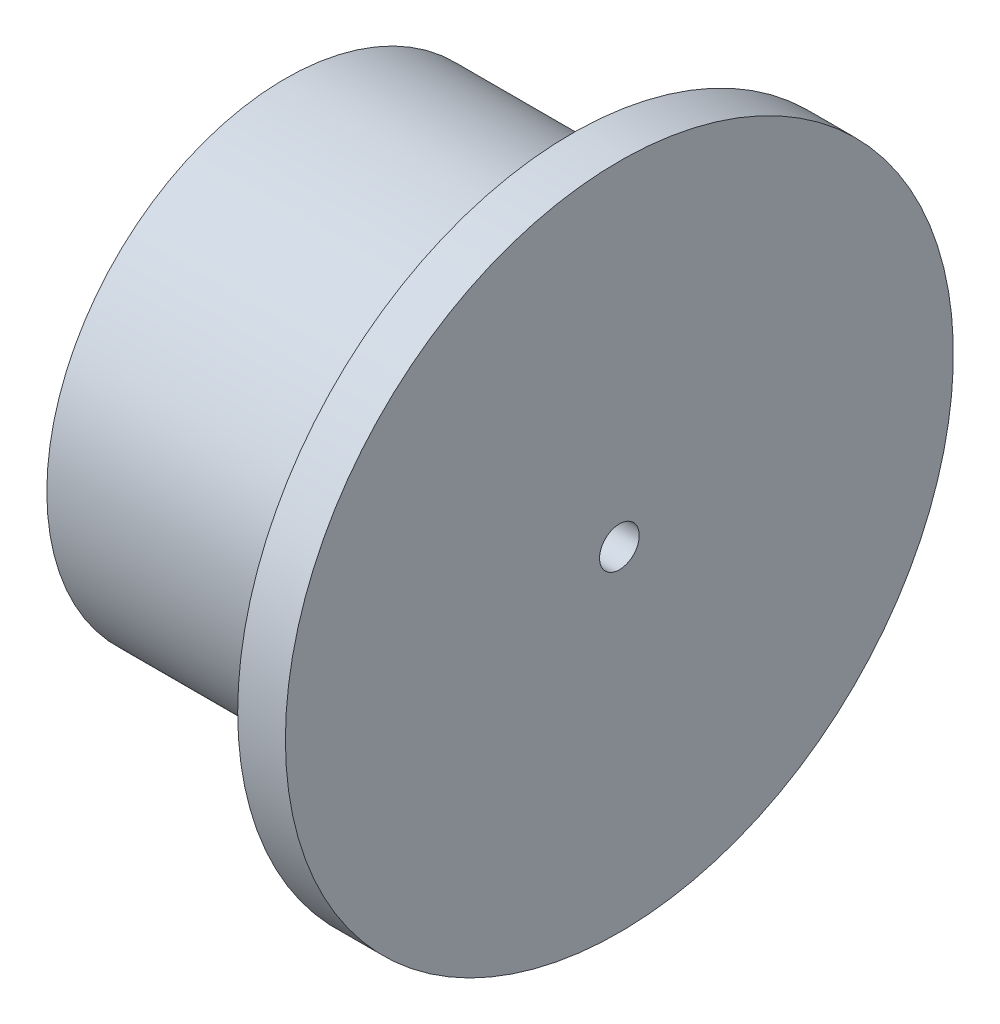
from build123d import *

# Parameters (mm, degrees)
SKETCH3_R          = 2.6416
CUT_EXTRUDE1_DEPTH = 81.82230509


with BuildPart() as part:
    # Sketch2 → Revolve1 (revolve)
    with BuildSketch(Plane.XY, mode=Mode.PRIVATE) as revolve1_sk:
        Polygon((3.81, 25.4), (41.91, 25.4), (41.91, 38.1), (48.26, 38.1), (48.26, -6.35), (3.81, -6.35), align=None)
    revolve(revolve1_sk.sketch.rotate(Axis((3.81, -6.35, 0), (1, 0, 0)), 90), axis=Axis((3.81, -6.35, 0), (1, 0, 0)))

    # Sketch3 → Cut-Extrude1 (cut, through all)
    with BuildSketch(Plane(origin=(48.26, 0, 0), x_dir=(0, 0, -1), z_dir=(1, 0, 0))):
        with Locations((0, -6.35)):
            Circle(SKETCH3_R)
    extrude(amount=-CUT_EXTRUDE1_DEPTH, mode=Mode.SUBTRACT)


solid = part.part
